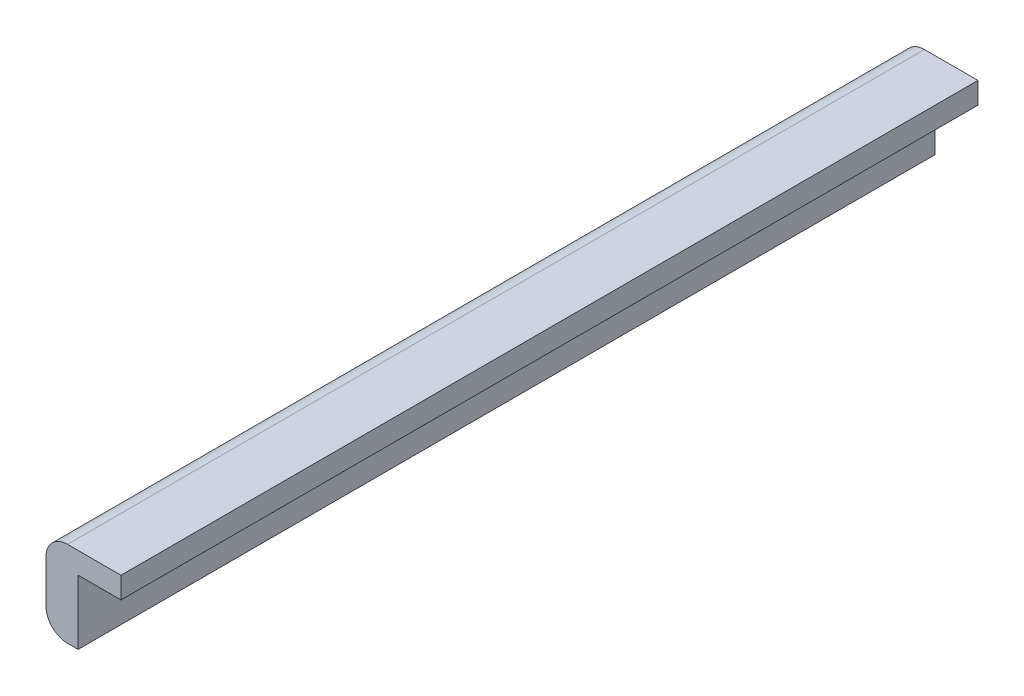
from build123d import *

# Parameters (mm, degrees)
BOSS_EXTRUDE1_DEPTH = 80


with BuildPart() as part:
    # Sketch1 → Boss-Extrude1 (new body)
    with BuildSketch(Plane.XY):
        with BuildLine():
            Line((0, 0), (0, -6))
            Line((0, -6), (-1, -6))
            ThreePointArc((-1, -6), (-2.414213562, -5.414213562), (-3, -4))
            Line((-3, -4), (-3, 0))
            ThreePointArc((-3, 0), (-2.414213562, 1.414213562), (-1, 2))
            Line((-1, 2), (4, 2))
            Line((4, 2), (4, 0))
            Line((4, 0), (0, 0))
        make_face()
    extrude(amount=BOSS_EXTRUDE1_DEPTH)


solid = part.part
